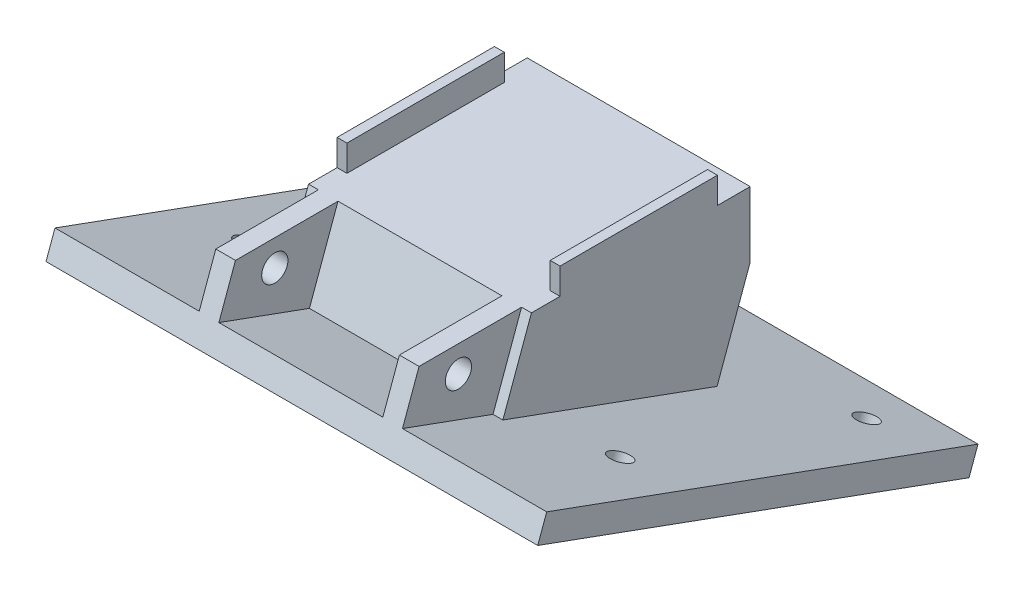
from build123d import *

# Parameters (mm, degrees)
SKETCH_1_W           = 34
SKETCH_1_H           = 49
EXTRUDE_1_DEPTH      = 10
SKETCH_2_W           = 1.5
SKETCH_2_H           = 24
EXTRUDE_2_DEPTH      = 4
SKETCH_3_W           = 1.5
SKETCH_3_H           = 12
SKETCH_3_W_2         = 25
SKETCH_3_H_2         = 13
CUT_EXTRUDE_1_DEPTH  = 10
CUT_EXTRUDE_2_REACH  = 45.041
SKETCH_4_R           = 2
EXTRUDE_3_DEPTH      = 8
CUT_EXTRUDE_4_DEPTH  = 10
EXTRUDE_4_DEPTH      = 3
EXTRUDE_5_DEPTH      = 3
EXTRUDE_6_DEPTH      = 3
EXTRUDE_7_DEPTH      = 34
EXTRUDE_8_DEPTH      = 3
EXTRUDE_9_REACH      = 45.432
CUT_EXTRUDE_10_DEPTH = 1.5
CUT_EXTRUDE_11_DEPTH = 1.5
CUT_EXTRUDE_12_DEPTH = 25
SKETCH_18_W          = 75
SKETCH_18_H          = 70
SKETCH_18_R          = 1.65
EXTRUDE_10_DEPTH     = 2


with BuildPart() as part:
    # 草图1 → 凸台-拉伸1 (new body)
    with BuildSketch(Plane(origin=(0, 0, 0), x_dir=(1, 0, 0), z_dir=(0, 1, 0))):
        Rectangle(SKETCH_1_W, SKETCH_1_H)
    extrude(amount=EXTRUDE_1_DEPTH)

    # 草图2 → 凸台-拉伸2 (add)
    with BuildSketch(Plane(origin=(0, 10, 0), x_dir=(1, 0, 0), z_dir=(0, 1, 0))):
        with Locations((-16.25, 7.5)):
            Rectangle(SKETCH_2_W, SKETCH_2_H)
        with Locations((16.25, 7.5)):
            Rectangle(SKETCH_2_W, SKETCH_2_H)
    extrude(amount=EXTRUDE_2_DEPTH)

    # 草图3 → 切除-拉伸1 (cut)
    with BuildSketch(Plane(origin=(0, 10, 0), x_dir=(1, 0, 0), z_dir=(0, 1, 0))):
        with Locations((-16.25, -18.5)):
            Rectangle(SKETCH_3_W, SKETCH_3_H)
        with Locations((16.25, -18.5)):
            Rectangle(SKETCH_3_W, SKETCH_3_H)
        with Locations((0, -18)):
            Rectangle(SKETCH_3_W_2, SKETCH_3_H_2)
    extrude(amount=-CUT_EXTRUDE_1_DEPTH, mode=Mode.SUBTRACT)

    # 切除-拉伸2: up to this face of the body (flat: up to its plane)
    cut_extrude_2_end = Plane(part.part.faces().sort_by_distance((15.5, 5, 18.5))[0])
    # 草图4 → 切除-拉伸2 (cut, up to the picked face)
    with BuildSketch(Plane.ZY.offset(15.5), mode=Mode.PRIVATE) as cut_extrude_2_sk1:
        with Locations((18.5, 6)):
            Circle(SKETCH_4_R)
    cut_extrude_2_tool1 = split(extrude(cut_extrude_2_sk1.sketch, amount=-CUT_EXTRUDE_2_REACH, mode=Mode.PRIVATE), bisect_by=cut_extrude_2_end, keep=Keep.BOTH, mode=Mode.PRIVATE)
    add(cut_extrude_2_tool1.solids().sort_by(Axis((-15.5, 6, 18.5), (1, 0, 0)))[0], mode=Mode.SUBTRACT)

    # 草图5 → 凸台-拉伸3 (add)
    with BuildSketch(Plane.XZ):
        Polygon((4, 11.5), (-4, 11.5), (-4, 41.5), (-13, 41.5), (-13, 56.5), (13, 56.5), (13, 41.5), (4, 41.5), align=None)
    extrude(amount=-EXTRUDE_3_DEPTH)

    # 草图5<2> → 切除-拉伸4 (cut)
    with BuildSketch(Plane.XZ):
        Polygon((4, 11.5), (-4, 11.5), (-4, 41.5), (-13, 41.5), (-13, 56.5), (13, 56.5), (13, 41.5), (4, 41.5), align=None)
    extrude(amount=-CUT_EXTRUDE_4_DEPTH, mode=Mode.SUBTRACT)

    # 草图7 → 凸台-拉伸4 (add)
    with BuildSketch(Plane.ZY.offset(15.5)):
        Polygon((24.5, 10), (27.713938048, 1.169777784), (24.5, 0), align=None)
    extrude(amount=-EXTRUDE_4_DEPTH)

    # 草图8 → 凸台-拉伸5 (add)
    with BuildSketch(Plane(origin=(15.5, 0, 0), x_dir=(0, 0, -1), z_dir=(1, 0, 0))):
        Polygon((-27.713938048, 1.169777784), (-24.5, 0), (-24.5, 10), align=None)
    extrude(amount=-EXTRUDE_5_DEPTH)

    # 草图9 → 凸台-拉伸6 (add)
    with BuildSketch(Plane(origin=(15.5, 0, 0), x_dir=(0, 0, -1), z_dir=(1, 0, 0))):
        Polygon((-12.5, 0), (-24.5, 0), (-13.903733341, -3.856725658), align=None)
    extrude(amount=-EXTRUDE_6_DEPTH)

    # 草图10 → 凸台-拉伸7 (add)
    with BuildSketch(Plane(origin=(17, 0, 0), x_dir=(0, 0, -1), z_dir=(1, 0, 0))):
        Polygon((-12.5, 0), (-13.903733341, -3.856725658), (18.768088856, -15.748296437), (24.5, 0), align=None)
    extrude(amount=-EXTRUDE_7_DEPTH)

    # 草图11 → 凸台-拉伸8 (add)
    with BuildSketch(Plane.ZY.offset(15.5)):
        Polygon((24.5, 0), (13.903733341, -3.856725658), (12.5, 0), align=None)
    extrude(amount=-EXTRUDE_8_DEPTH)

    # 草图12 → 凸台-拉伸9 (add, up to next)
    with BuildSketch(Plane(origin=(-12.5, 0, 0), x_dir=(0, 0, -1), z_dir=(1, 0, 0)), mode=Mode.PRIVATE) as extrude_9_sk1:
        Polygon((-12.5, 0), (-11.5, 2.747477419), (-11.5, 0), align=None)
    extrude_9_tool1 = extrude(extrude_9_sk1.sketch, amount=EXTRUDE_9_REACH, mode=Mode.PRIVATE) - part.part
    add(extrude_9_tool1.solids().sort_by_distance((-12.5, 0.915826, 11.833333))[0])

    # 草图13 → 切除-拉伸10 (cut)
    with BuildSketch(Plane(origin=(17, 0, 0), x_dir=(0, 0, -1), z_dir=(1, 0, 0))):
        Polygon((-12.5, 0), (-8.860297657, 10), (-12.5, 10), align=None)
    extrude(amount=-CUT_EXTRUDE_10_DEPTH, mode=Mode.SUBTRACT)

    # 草图16 → 切除-拉伸11 (cut)
    with BuildSketch(Plane.ZY.offset(17)):
        Polygon((12.5, 10), (12.5, 0), (8.860297657, 10), align=None)
    extrude(amount=-CUT_EXTRUDE_11_DEPTH, mode=Mode.SUBTRACT)

    # 草图17 → 切除-拉伸12 (cut)
    with BuildSketch(Plane(origin=(-12.5, 0, 0), x_dir=(0, 0, -1), z_dir=(1, 0, 0))):
        Polygon((-11.5, 2.747477419), (-11.5, 10), (-8.860297657, 10), align=None)
    extrude(amount=CUT_EXTRUDE_12_DEPTH, mode=Mode.SUBTRACT)

    # 草图18 → 凸台-拉伸10 (add, symmetric)
    with BuildSketch(Plane(origin=(0, -7.874148219, 2.865955572), x_dir=(1, 0, 0), z_dir=(0, -0.9396926207859081, 0.34202014332566943))):
        with Locations((0, -8.557329357)):
            Rectangle(SKETCH_18_W, SKETCH_18_H)
        with Locations(Location((28.5, 4.942670643, 0), (0, 0, 270))):
            Circle(SKETCH_18_R, mode=Mode.SUBTRACT)
        with Locations(Location((28.5, -35.057329357, 0), (0, 0, 270))):
            Circle(SKETCH_18_R, mode=Mode.SUBTRACT)
        with Locations(Location((-28.5, 4.942670643, 0), (0, 0, 270))):
            Circle(SKETCH_18_R, mode=Mode.SUBTRACT)
        with Locations(Location((-28.5, -35.057329357, 0), (0, 0, 270))):
            Circle(SKETCH_18_R, mode=Mode.SUBTRACT)
    extrude(amount=EXTRUDE_10_DEPTH, both=True)


solid = part.part
